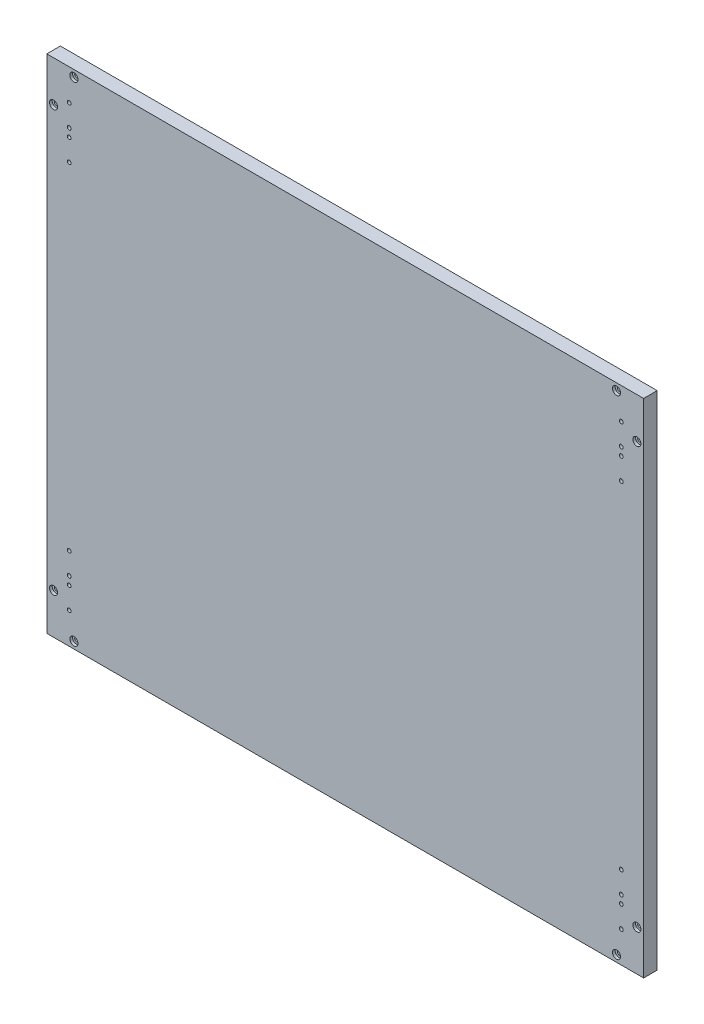
from build123d import *

# Parameters (mm, degrees)
SKETCH1_W            = 420
SKETCH1_H            = 350
BOSS_EXTRUDE1_DEPTH  = 10
SKETCH29_W           = 440
SKETCH29_H           = 370
BOSS_EXTRUDE11_DEPTH = 10
SKETCH30_R           = 3
CUT_EXTRUDE1_DEPTH   = 561.892146495
SKETCH33_R           = 3.469429077
SKETCH33_R_2         = 4.503034471
SKETCH33_R_3         = 4.282629776
SKETCH33_R_4         = 4.627633979
BOSS_EXTRUDE12_DEPTH = 10
SKETCH32_R           = 1.4
CUT_EXTRUDE3_DEPTH   = 10
SKETCH35_R           = 1.4
CUT_EXTRUDE5_DEPTH   = 10
SKETCH37_R           = 3
CUT_EXTRUDE7_DEPTH   = 2


with BuildPart() as part:
    # Sketch1 → Boss-Extrude1 (new body)
    with BuildSketch(Plane.XY):
        with Locations((210, 175)):
            Rectangle(SKETCH1_W, SKETCH1_H)
    extrude(amount=BOSS_EXTRUDE1_DEPTH)

    # Sketch29 → Boss-Extrude11 (add)
    with BuildSketch(Plane(origin=(0, 0, 0), x_dir=(-1, 0, 0), z_dir=(0, 0, -1))):
        with Locations((-210, 175)):
            Rectangle(SKETCH29_W, SKETCH29_H)
    extrude(amount=-BOSS_EXTRUDE11_DEPTH)

    # Sketch30 → Cut-Extrude1 (cut, through all)
    with BuildSketch(Plane(origin=(0, 0, 0), x_dir=(-1, 0, 0), z_dir=(0, 0, -1))):
        with Locations((-424, 354)):
            Circle(SKETCH30_R)
        with Locations((-424, -4)):
            Circle(SKETCH30_R)
        with Locations((4, -4)):
            Circle(SKETCH30_R)
        with Locations((4, 354)):
            Circle(SKETCH30_R)
    extrude(amount=-CUT_EXTRUDE1_DEPTH, mode=Mode.SUBTRACT)

    # Sketch33 → Boss-Extrude12 (add)
    with BuildSketch(Plane.XY.offset(10)):
        with Locations((-4, 354)):
            Circle(SKETCH33_R)
        with Locations((-4, -4)):
            Circle(SKETCH33_R_2)
        with Locations((424, -4)):
            Circle(SKETCH33_R_3)
        with Locations((424, 354)):
            Circle(SKETCH33_R_4)
    extrude(amount=-BOSS_EXTRUDE12_DEPTH)

    # Sketch32 → Cut-Extrude3 (cut)
    with BuildSketch(Plane.XY.offset(10)):
        with Locations((6.5, 337)):
            Circle(SKETCH32_R)
        with Locations((6.5, 321)):
            Circle(SKETCH32_R)
        with Locations((6.5, 315)):
            Circle(SKETCH32_R)
        with Locations((6.5, 299)):
            Circle(SKETCH32_R)
        with Locations((6.5, 51)):
            Circle(SKETCH32_R)
        with Locations((6.5, 35)):
            Circle(SKETCH32_R)
        with Locations((6.5, 29)):
            Circle(SKETCH32_R)
        with Locations((6.5, 13)):
            Circle(SKETCH32_R)
        with Locations((413.5, 13)):
            Circle(SKETCH32_R)
        with Locations((413.5, 29)):
            Circle(SKETCH32_R)
        with Locations((413.5, 35)):
            Circle(SKETCH32_R)
        with Locations((413.5, 51)):
            Circle(SKETCH32_R)
        with Locations((413.5, 299)):
            Circle(SKETCH32_R)
        with Locations((413.5, 321)):
            Circle(SKETCH32_R)
        with Locations((413.5, 315)):
            Circle(SKETCH32_R)
        with Locations((413.5, 337)):
            Circle(SKETCH32_R)
    extrude(amount=-CUT_EXTRUDE3_DEPTH, mode=Mode.SUBTRACT)

    # Sketch35 → Cut-Extrude5 (cut)
    with BuildSketch(Plane(origin=(0, 0, 0), x_dir=(-1, 0, 0), z_dir=(0, 0, -1))):
        with Locations((-410, 355)):
            Circle(SKETCH35_R)
        with Locations((-10, 355)):
            Circle(SKETCH35_R)
        with Locations((5, 330)):
            Circle(SKETCH35_R)
        with Locations((5, 20)):
            Circle(SKETCH35_R)
        with Locations((-10, -5)):
            Circle(SKETCH35_R)
        with Locations((-410, -5)):
            Circle(SKETCH35_R)
        with Locations((-425, 330)):
            Circle(SKETCH35_R)
        with Locations((-425, 20)):
            Circle(SKETCH35_R)
    extrude(amount=-CUT_EXTRUDE5_DEPTH, mode=Mode.SUBTRACT)

    # Sketch37 → Cut-Extrude7 (cut)
    with BuildSketch(Plane.XY.offset(10)):
        with Locations((10, 355)):
            Circle(SKETCH37_R)
        with Locations((-5, 330)):
            Circle(SKETCH37_R)
        with Locations((-5, 20)):
            Circle(SKETCH37_R)
        with Locations((10, -5)):
            Circle(SKETCH37_R)
        with Locations((410, -5)):
            Circle(SKETCH37_R)
        with Locations((425, 20)):
            Circle(SKETCH37_R)
        with Locations((410, 355)):
            Circle(SKETCH37_R)
        with Locations((425, 330)):
            Circle(SKETCH37_R)
    extrude(amount=-CUT_EXTRUDE7_DEPTH, mode=Mode.SUBTRACT)


solid = part.part
